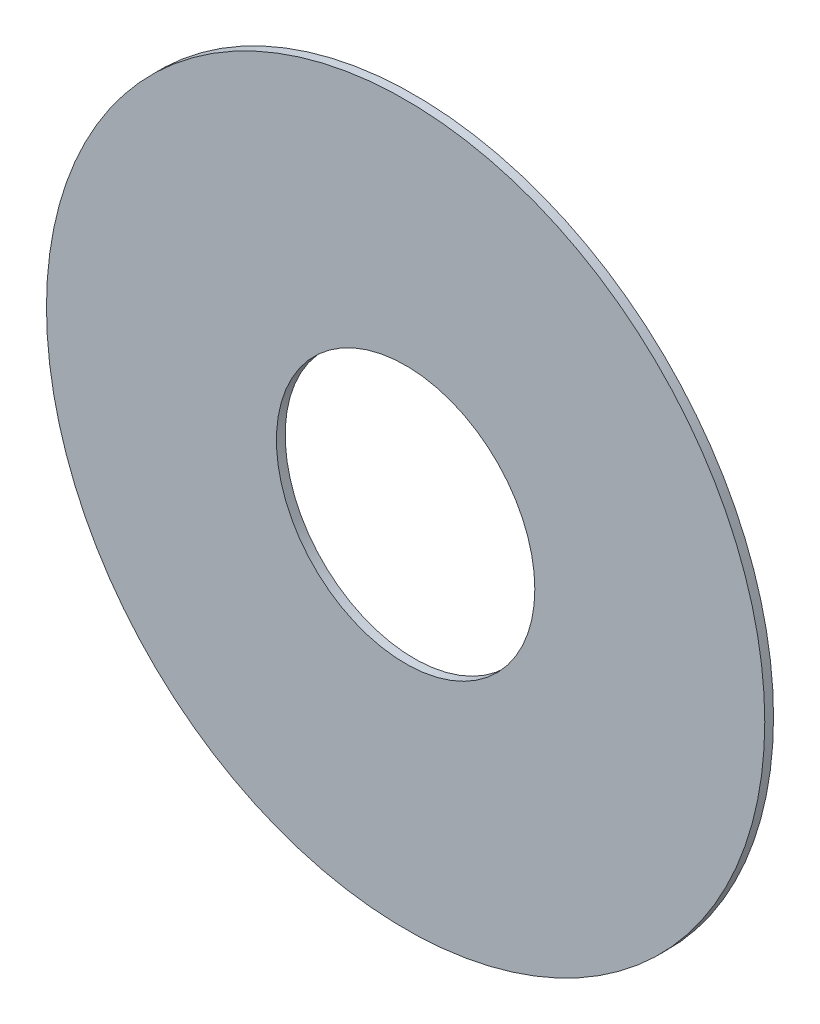
from build123d import *

# Parameters (mm, degrees)
PRINTED_GUARD_START = -42.5
SKETCH_1_R          = 82
SKETCH_1_R_2        = 29.5
PRINTED_GUARD_DEPTH = 2


with BuildPart() as part:
    # Эскиз1 → Printed_guard (new body)
    with BuildSketch(Plane.XY.offset(PRINTED_GUARD_START)):
        Circle(SKETCH_1_R)
        Circle(SKETCH_1_R_2, mode=Mode.SUBTRACT)
    extrude(amount=PRINTED_GUARD_DEPTH)


solid = part.part
